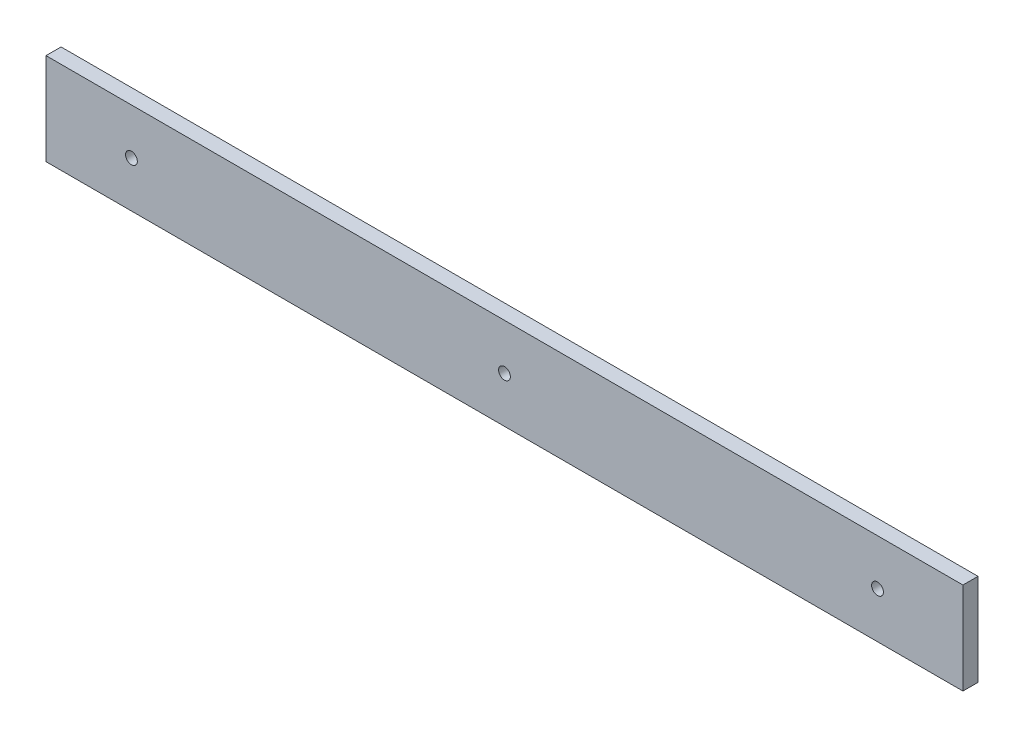
from build123d import *

# Parameters (mm, degrees)
SKETCH1_W           = 97.398000022
SKETCH1_H           = 9.757695242
BOSS_EXTRUDE1_DEPTH = 1.6002
SKETCH2_R           = 0.625
CUT_EXTRUDE1_DEPTH  = 98.898639749


with BuildPart() as part:
    # Sketch1 → Boss-Extrude1 (new body)
    with BuildSketch(Plane.XY):
        with Locations((48.699000011, 4.878847621)):
            Rectangle(SKETCH1_W, SKETCH1_H)
    extrude(amount=BOSS_EXTRUDE1_DEPTH)

    # Sketch2 → Cut-Extrude1 (cut, through all)
    with BuildSketch(Plane.XY.offset(1.6002)):
        with Locations((9.074999884, 4.878847621)):
            Circle(SKETCH2_R)
        with Locations((48.698999884, 4.878847621)):
            Circle(SKETCH2_R)
        with Locations((88.323000138, 4.878847621)):
            Circle(SKETCH2_R)
    extrude(amount=-CUT_EXTRUDE1_DEPTH, mode=Mode.SUBTRACT)


solid = part.part
